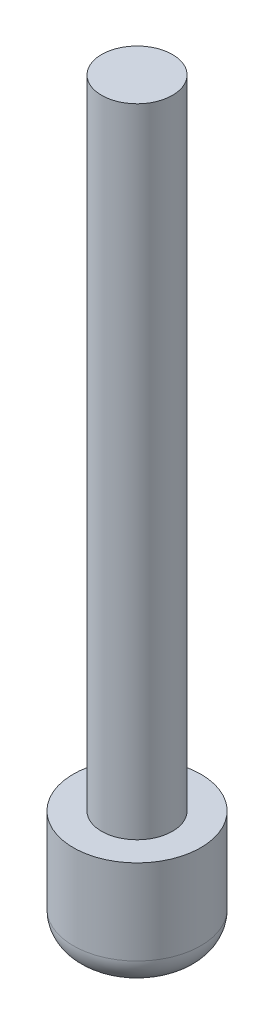
from build123d import *

# Parameters (mm, degrees)
SKETCH1_R           = 1.25
BOSS_EXTRUDE1_DEPTH = 22.5
SKETCH2_R           = 2.25
BOSS_EXTRUDE2_DEPTH = 4
FILLET1_R           = 1


with BuildPart() as part:
    # Sketch1 → Boss-Extrude1 (new body)
    with BuildSketch(Plane(origin=(0, 0, 0), x_dir=(1, 0, 0), z_dir=(0, 1, 0))):
        with Locations(Location((0, 0.166154527, 0), (0, 0, 90))):
            Circle(SKETCH1_R)
    extrude(amount=BOSS_EXTRUDE1_DEPTH)

    # Sketch2 → Boss-Extrude2 (add)
    with BuildSketch(Plane(origin=(0, 0, 0), x_dir=(-1, 0, 0), z_dir=(0, -1, 0))):
        with Locations(Location((0, 0.166154527, 0), (0, 0, 90))):
            Circle(SKETCH2_R)
    extrude(amount=BOSS_EXTRUDE2_DEPTH)

    # Fillet1
    fillet1_edges = [part.edges().sort_by_distance(p)[0] for p in [
        (0, -4, 2.083845473),
    ]]
    fillet(fillet1_edges, radius=FILLET1_R)


solid = part.part
